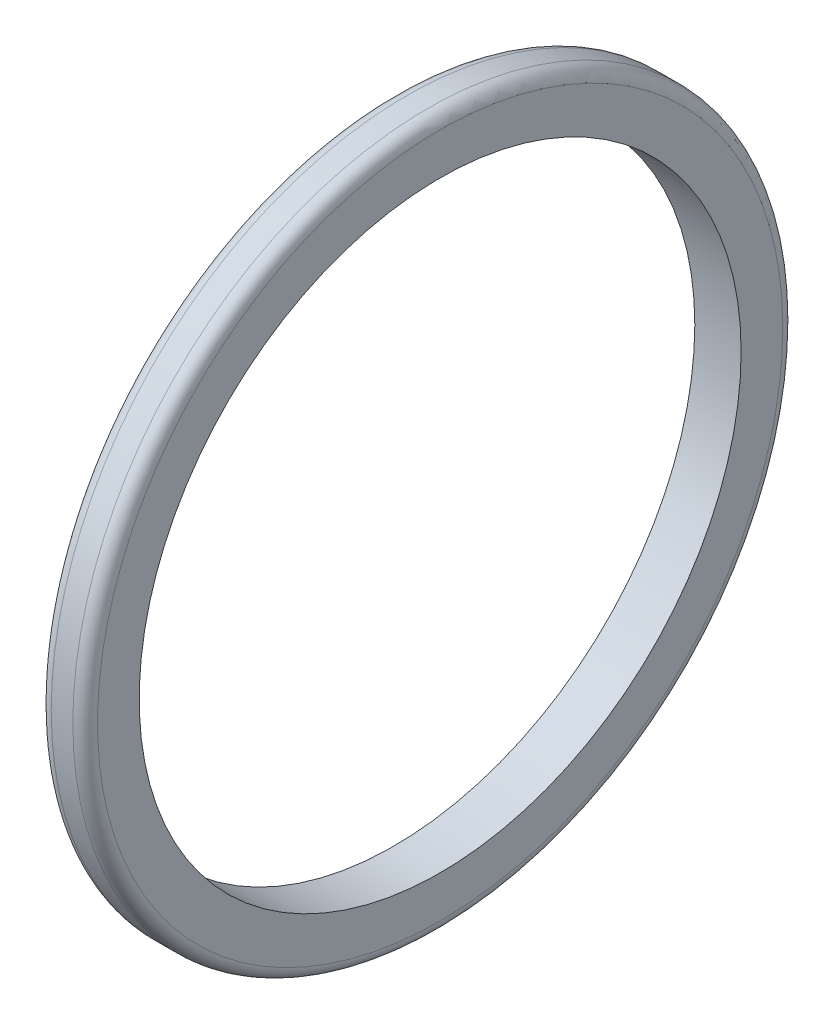
from build123d import *

# Parameters (mm, degrees)
SKETCH1_R           = 230
BOSS_EXTRUDE1_DEPTH = 30
FILLET1_R           = 8
SKETCH2_R           = 195
CUT_EXTRUDE1_DEPTH  = 327.649659421


with BuildPart() as part:
    # Sketch1 → Boss-Extrude1 (new body)
    with BuildSketch(Plane(origin=(0, 0, 0), x_dir=(0, 0, -1), z_dir=(1, 0, 0))):
        Circle(SKETCH1_R)
    extrude(amount=BOSS_EXTRUDE1_DEPTH)

    # Fillet1
    fillet1_edges = [part.edges().sort_by_distance(p)[0] for p in [
        (0, 0, 230),
        (30, 0, 230),
    ]]
    fillet(fillet1_edges, radius=FILLET1_R)

    # Sketch2 → Cut-Extrude1 (cut, through all)
    with BuildSketch(Plane(origin=(30, 0, 0), x_dir=(0, 0, -1), z_dir=(1, 0, 0))):
        Circle(SKETCH2_R)
    extrude(amount=-CUT_EXTRUDE1_DEPTH, mode=Mode.SUBTRACT)


solid = part.part
